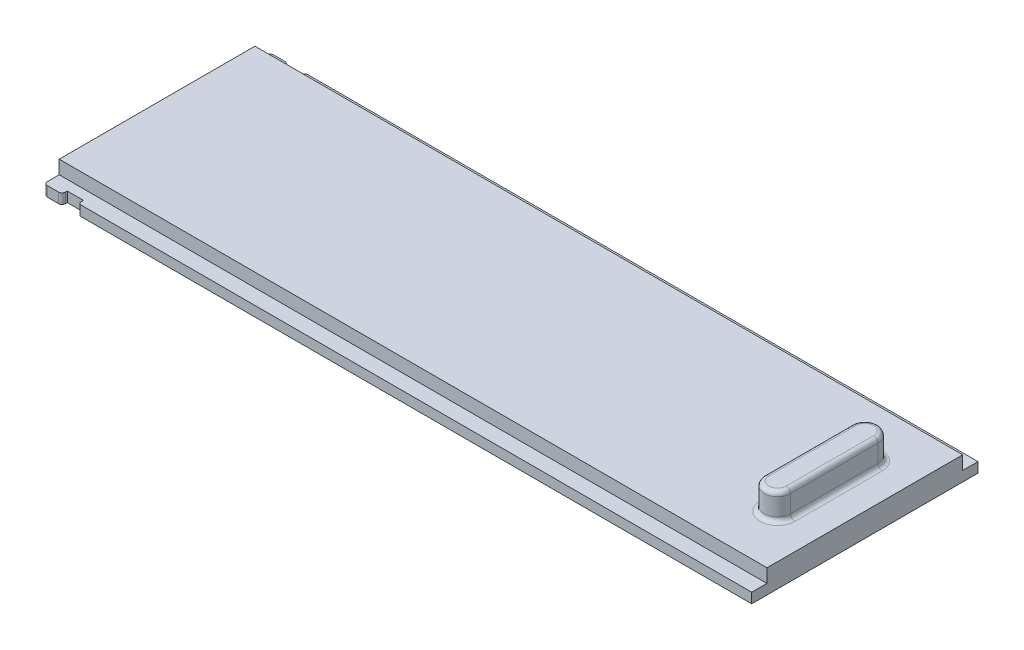
from build123d import *

# Parameters (mm, degrees)
SKETCH1_W           = 81
SKETCH1_H           = 29
BOSS_EXTRUDE1_DEPTH = 3
CUT_EXTRUDE2_DEPTH  = 81
CUT_EXTRUDE3_DEPTH  = 81
SKETCH6_W           = 1.85
SKETCH6_H           = 1.55
CUT_EXTRUDE5_DEPTH  = 0.6
FILLET6_R           = 0.4
CHAMFER2_SIZE       = 0.2
SKETCH7_W           = 1.85
SKETCH7_H           = 1.55
CUT_EXTRUDE6_DEPTH  = 0.6
FILLET7_R           = 0.4
CHAMFER3_SIZE       = 0.2
SKETCH11_W          = 81
SKETCH11_H          = 25.9
CUT_EXTRUDE7_DEPTH  = 0.2
FILLET8_R           = 0.4
BOSS_EXTRUDE2_DEPTH = 3
FILLET11_R          = 0.5
CUT_EXTRUDE8_REACH  = 87.735
SKETCH12_W          = 25.9
SKETCH12_H          = 0.1


with BuildPart() as part:
    # Sketch1 → Boss-Extrude1 (new body)
    with BuildSketch(Plane(origin=(0, 0, 0), x_dir=(1, 0, 0), z_dir=(0, 1, 0))):
        with Locations((40.5, 14.5)):
            Rectangle(SKETCH1_W, SKETCH1_H)
    extrude(amount=BOSS_EXTRUDE1_DEPTH)

    # Sketch2 → Cut-Extrude2 (cut)
    with BuildSketch(Plane(origin=(81, 0, 0), x_dir=(0, 0, -1), z_dir=(1, 0, 0))):
        Polygon((0, 3), (3, 3), (3, 1.75), (1.25, 1.75), (1.25, 0), (0, 0), align=None)
        Polygon((29, 0), (27.75, 0), (27.75, 1.75), (26, 1.75), (26, 3), (29, 3), align=None)
    extrude(amount=-CUT_EXTRUDE2_DEPTH, mode=Mode.SUBTRACT)

    # Sketch4 → Cut-Extrude3 (cut)
    with BuildSketch(Plane(origin=(81, 0, 0), x_dir=(0, 0, -1), z_dir=(1, 0, 0))):
        Polygon((27.75, 0), (27.45, 0), (27.45, 1.45), (25.7, 1.45), (25.7, 3), (26, 3), (26, 1.75), (27.75, 1.75), align=None)
        Polygon((3.3, 3), (3, 3), (3, 1.75), (1.25, 1.75), (1.25, 0), (1.55, 0), (1.55, 1.45), (3.3, 1.45), align=None)
    extrude(amount=-CUT_EXTRUDE3_DEPTH, mode=Mode.SUBTRACT)

    # Sketch6 → Cut-Extrude5 (cut)
    with BuildSketch(Plane.XY.offset(-1.55)):
        with Locations((3, 0.675)):
            Rectangle(SKETCH6_W, SKETCH6_H)
    extrude(amount=-CUT_EXTRUDE5_DEPTH, mode=Mode.SUBTRACT)

    # Fillet6
    fillet6_edges = [part.edges().sort_by_distance(p)[0] for p in [
        (2.075, 0.725, -1.55),
    ]]
    fillet(fillet6_edges, radius=FILLET6_R)

    # Chamfer2
    chamfer2_edges = [part.edges().sort_by_distance(p)[0] for p in [
        (3.925, 0.725, -1.55),
    ]]
    chamfer(chamfer2_edges, length=CHAMFER2_SIZE)

    # Sketch7 → Cut-Extrude6 (cut)
    with BuildSketch(Plane(origin=(0, 0, -27.45), x_dir=(-1, 0, 0), z_dir=(0, 0, -1))):
        with Locations((-3, 0.675)):
            Rectangle(SKETCH7_W, SKETCH7_H)
    extrude(amount=-CUT_EXTRUDE6_DEPTH, mode=Mode.SUBTRACT)

    # Fillet7
    fillet7_edges = [part.edges().sort_by_distance(p)[0] for p in [
        (2.075, 0.725, -27.45),
    ]]
    fillet(fillet7_edges, radius=FILLET7_R)

    # Chamfer3
    chamfer3_edges = [part.edges().sort_by_distance(p)[0] for p in [
        (3.925, 0.725, -27.45),
    ]]
    chamfer(chamfer3_edges, length=CHAMFER3_SIZE)

    # Sketch11 → Cut-Extrude7 (cut)
    with BuildSketch(Plane(origin=(0, 0, 0), x_dir=(-1, 0, 0), z_dir=(0, -1, 0))):
        with Locations((-40.5, 14.5)):
            Rectangle(SKETCH11_W, SKETCH11_H)
    extrude(amount=-CUT_EXTRUDE7_DEPTH, mode=Mode.SUBTRACT)

    # Fillet8
    fillet8_edges = [part.edges().sort_by_distance(p)[0] for p in [
        (0, 0.825, -27.45),
        (0, 0.825, -1.55),
    ]]
    fillet(fillet8_edges, radius=FILLET8_R)

    # Sketch9 → Boss-Extrude2 (add)
    with BuildSketch(Plane(origin=(0, 3, 0), x_dir=(1, 0, 0), z_dir=(0, 1, 0))):
        with BuildLine():
            Line((74.5, 9.5), (74.5, 19.5))
            ThreePointArc((74.5, 19.5), (76, 21), (77.5, 19.5))
            Line((77.5, 19.5), (77.5, 9.5))
            ThreePointArc((77.5, 9.5), (76, 8), (74.5, 9.5))
        make_face()
    extrude(amount=BOSS_EXTRUDE2_DEPTH)

    # Fillet11
    fillet11_edges = [part.edges().sort_by_distance(p)[0] for p in [
        (76, 3, -8),
        (77.5, 3, -14.5),
        (76, 3, -21),
        (74.5, 3, -14.5),
        (76, 6, -8),
        (77.5, 6, -14.5),
        (76, 6, -21),
        (74.5, 6, -14.5),
    ]]
    fillet(fillet11_edges, radius=FILLET11_R)

    # Cut-Extrude8: up to this face of the body (flat: up to its plane)
    cut_extrude8_end = Plane(part.part.faces().sort_by_distance((0, 1.56042628, -14.5))[0])
    # Sketch12 → Cut-Extrude8 (cut, up to the picked face)
    with BuildSketch(Plane(origin=(81, 0, 0), x_dir=(0, 0, -1), z_dir=(1, 0, 0)), mode=Mode.PRIVATE) as cut_extrude8_sk1:
        with Locations((14.5, 0.25)):
            Rectangle(SKETCH12_W, SKETCH12_H)
    cut_extrude8_tool1 = split(extrude(cut_extrude8_sk1.sketch, amount=-CUT_EXTRUDE8_REACH, mode=Mode.PRIVATE), bisect_by=cut_extrude8_end, keep=Keep.BOTH, mode=Mode.PRIVATE)
    add(cut_extrude8_tool1.solids().sort_by(Axis((81, 0.25, -14.5), (-1, 0, 0)))[0], mode=Mode.SUBTRACT)


solid = part.part
